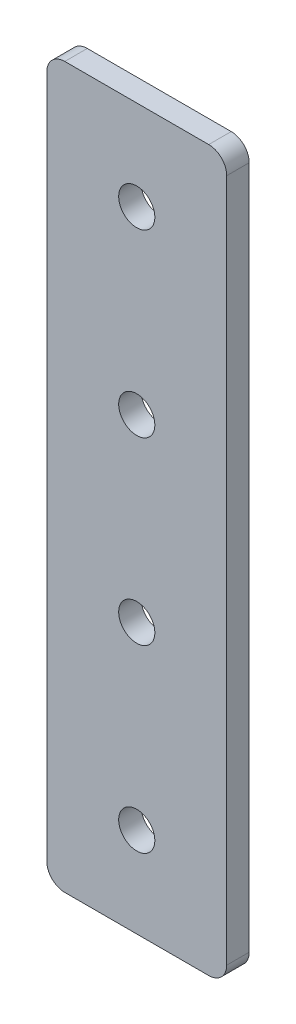
from build123d import *

# Parameters (mm, degrees)
SKETCH1_W           = 25.4
SKETCH1_H           = 101.6
SKETCH1_R           = 2.5527
BOSS_EXTRUDE1_DEPTH = 3.175
FILLET1_R           = 2.54


with BuildPart() as part:
    # Sketch1 → Boss-Extrude1 (new body)
    with BuildSketch(Plane.XY):
        with Locations((-12.7, 50.8)):
            Rectangle(SKETCH1_W, SKETCH1_H)
        with Locations((-12.7, 88.9)):
            Circle(SKETCH1_R, mode=Mode.SUBTRACT)
        with Locations((-12.7, 63.5)):
            Circle(SKETCH1_R, mode=Mode.SUBTRACT)
        with Locations((-12.7, 38.1)):
            Circle(SKETCH1_R, mode=Mode.SUBTRACT)
        with Locations((-12.7, 12.7)):
            Circle(SKETCH1_R, mode=Mode.SUBTRACT)
    extrude(amount=BOSS_EXTRUDE1_DEPTH)

    # Fillet1
    fillet1_edges = [part.edges().sort_by_distance(p)[0] for p in [
        (0, 0, 1.5875),
        (-25.4, 0, 1.5875),
        (-25.4, 101.6, 1.5875),
        (0, 101.6, 1.5875),
    ]]
    fillet(fillet1_edges, radius=FILLET1_R)


solid = part.part
